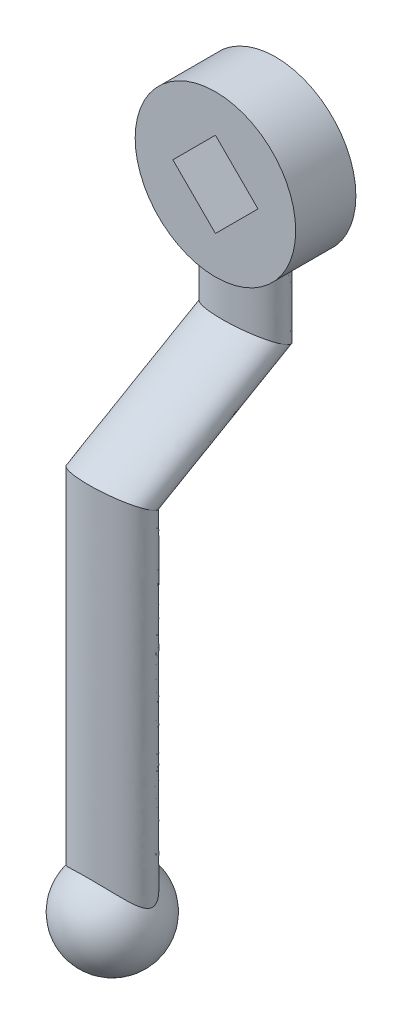
from build123d import *

# Parameters (mm, degrees)
BOSS_EXTRUDE1_DEPTH      = 4.5
BOSS_EXTRUDE1_DEPTH_BACK = 4.5
SKETCH1_R                = 12
SKETCH3_RX               = 6
SKETCH3_RY               = 3.5
CUT_EXTRUDE1_REACH       = 98.896


with BuildPart() as part:
    # Sketch1 → Boss-Extrude1 (new, two sides: drawn at the far end of the back side and taken through both)
    with BuildSketch(Plane(origin=(0, 0, 0), x_dir=(0, 1, 0), z_dir=(0, 0, 1)).offset(-BOSS_EXTRUDE1_DEPTH_BACK)):
        Circle(SKETCH1_R)
    extrude(amount=BOSS_EXTRUDE1_DEPTH + BOSS_EXTRUDE1_DEPTH_BACK)

    # Sweep1: sweep along a path in Sketch2
    with BuildLine(Plane.YZ) as sweep1_path:
        Line((0, 0), (-20, 0))
        Line((-20, 0), (-31.5, 19.918584287))
        Line((-31.5, 19.918584287), (-86.5, 19.918584287))
    # Sketch3 → Sweep1 (sweep)
    with BuildSketch(Plane(origin=(0, 0, 0), x_dir=(-1, 0, 0), z_dir=(0, 1, 0))):
        with Locations((0, 0)):
            Ellipse(SKETCH3_RX, SKETCH3_RY)
    sweep(path=sweep1_path.line, transition=Transition.RIGHT)

    # Sketch4 → Revolve1 (revolve)
    with BuildSketch(Plane.XZ.offset(86.5)):
        with BuildLine():
            Line((0, 26.918584287), (0, 12.918584287))
            ThreePointArc((0, 12.918584287), (7, 19.918584287), (0, 26.918584287))
        make_face()
    revolve(axis=Axis((0, -86.5, 26.918584287), (0, 0, -1)))

    # Sketch5 → Cut-Extrude1 (cut, up to next)
    with BuildSketch(Plane.XY.offset(4.5), mode=Mode.PRIVATE) as cut_extrude1_sk1:
        Polygon((0, 6.363961031), (-6.363961031, 0), (0, -6.363961031), (6.363961031, 0), align=None)
    cut_extrude1_tool1 = extrude(cut_extrude1_sk1.sketch, amount=-CUT_EXTRUDE1_REACH, mode=Mode.PRIVATE) & part.part
    add(cut_extrude1_tool1.solids().sort_by_distance((0, 0, 4.5))[0], mode=Mode.SUBTRACT)


solid = part.part
